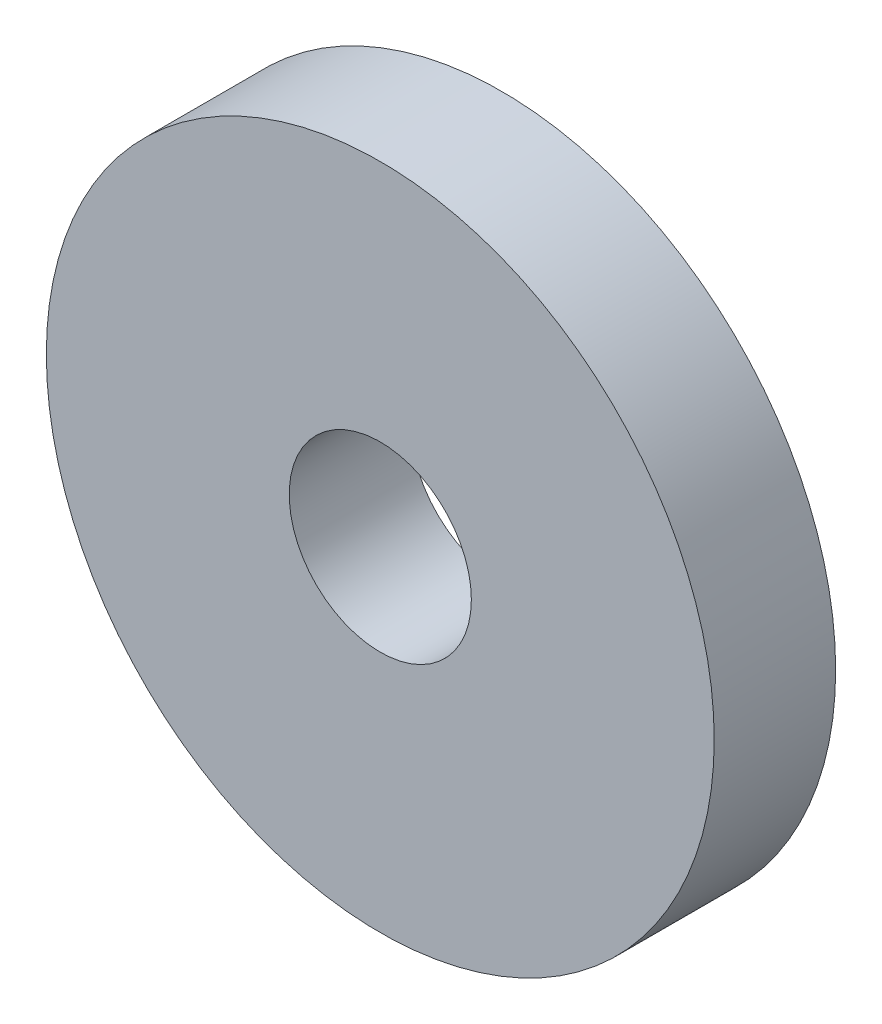
from build123d import *

# Parameters (mm, degrees)
SKETCH1_R          = 5.5
EXTRUDE1_DEPTH     = 2
SKETCH2_R          = 1.5
CUT_EXTRUDE1_DEPTH = 9.031189202


with BuildPart() as part:
    # Sketch1 → Extrude1 (new body)
    with BuildSketch(Plane.XY):
        Circle(SKETCH1_R)
    extrude(amount=EXTRUDE1_DEPTH)

    # Sketch2 → Cut-Extrude1 (cut, through all)
    with BuildSketch(Plane.XY.offset(2)):
        Circle(SKETCH2_R)
    extrude(amount=-CUT_EXTRUDE1_DEPTH, mode=Mode.SUBTRACT)


solid = part.part
